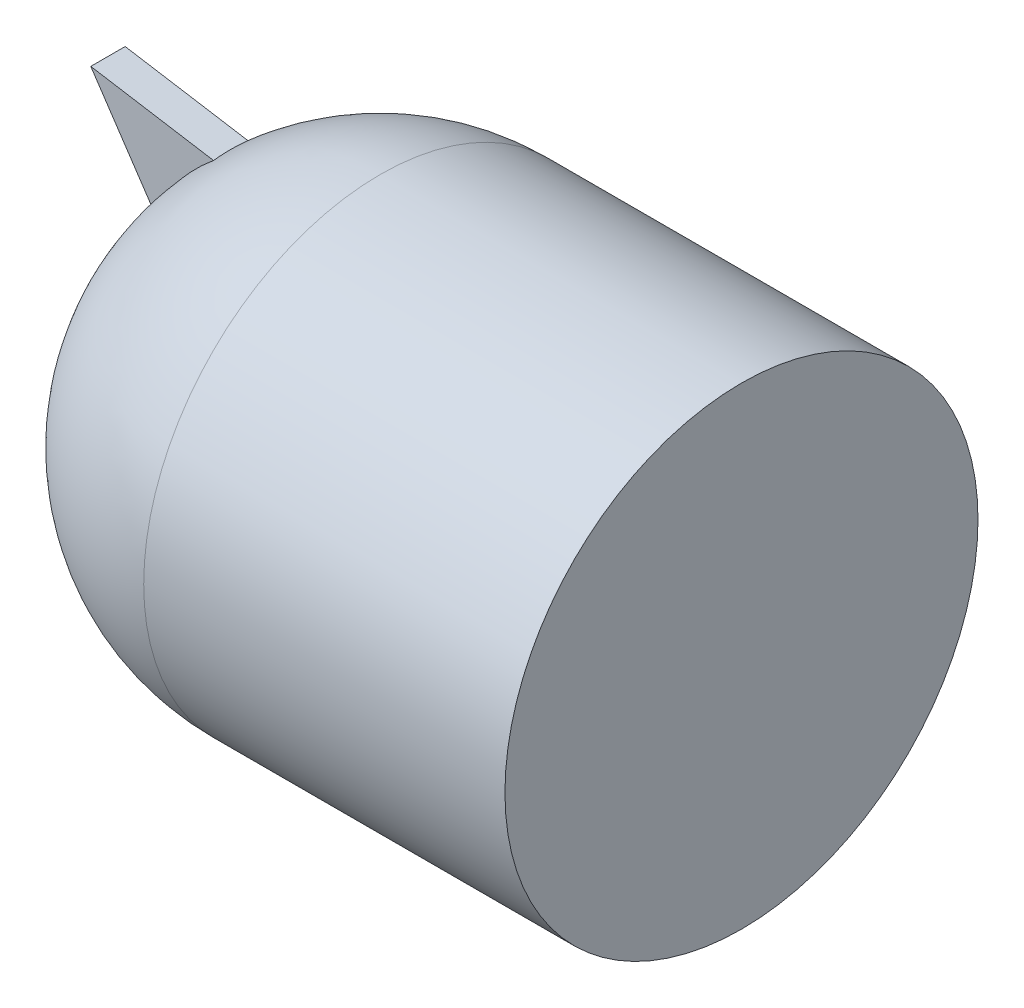
from build123d import *

# Parameters (mm, degrees)
EXTRUDE_1_DEPTH      = 10
EXTRUDE_1_DEPTH_BACK = 10


with BuildPart() as part:
    # ｽｹｯﾁ2 → 回転-薄板1 (revolve)
    with BuildSketch(Plane.XY):
        with BuildLine():
            ThreePointArc((-327.5, 0), (-290.156114601, 90.156114601), (-200, 127.5))
            Line((-200, 127.5), (0, 127.5))
            Line((0, 127.5), (0, 0))
            Line((0, 0), (10, 0))
            Line((10, 0), (10, 137.5))
            Line((10, 137.5), (-200, 137.5))
            ThreePointArc((-200, 137.5), (-297.227182413, 97.227182413), (-337.5, 0))
            Line((-337.5, 0), (-327.5, 0))
        make_face()
    revolve(axis=Axis((0, 0, 0), (-1, 0, 0)))

    # ｽｹｯﾁ3 → ﾎﾞｽ - 押し出し1 (add, two sides: drawn at the far end of the back side and taken through both)
    with BuildSketch(Plane.XY.offset(-EXTRUDE_1_DEPTH_BACK)):
        Polygon((-302.60266968, 34.89733032), (-358.272990838, 117.779688618), (-239.232172231, 98.267827769), align=None)
        Polygon((-358.272990838, -117.779688618), (-239.232172231, -98.267827769), (-302.60266968, -34.89733032), align=None)
    extrude(amount=EXTRUDE_1_DEPTH + EXTRUDE_1_DEPTH_BACK)


solid = part.part
